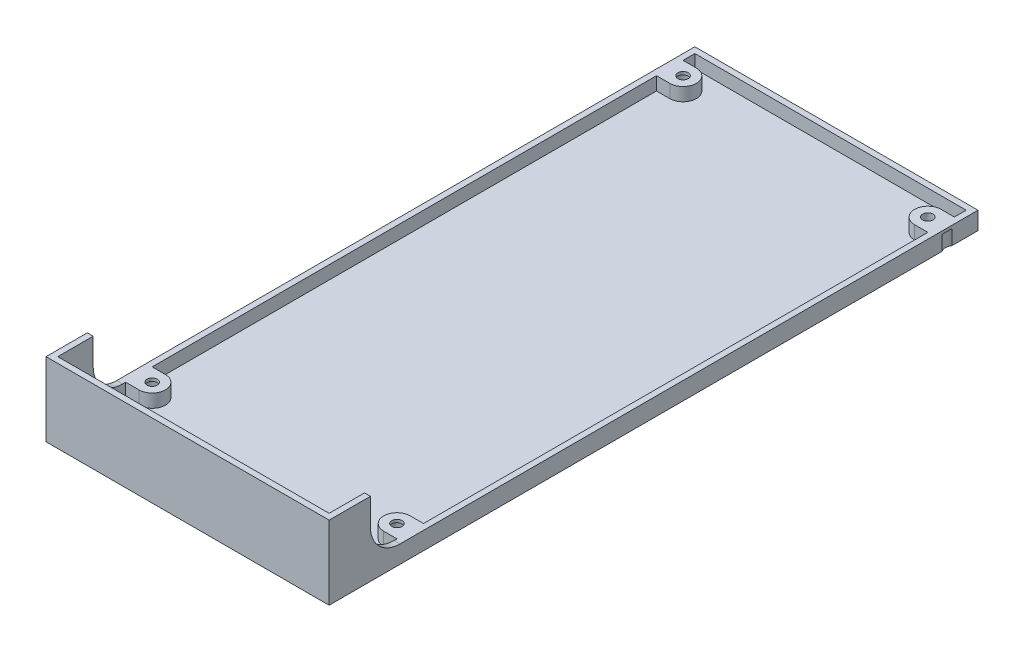
from build123d import *

# Parameters (mm, degrees)
SKETCH1_W           = 96
SKETCH1_H           = 220
BOSS_EXTRUDE1_DEPTH = 25
CUT_EXTRUDE1_DEPTH  = 23.5
CUT_EXTRUDE2_REACH  = 248.327
CUT_EXTRUDE3_REACH  = 247.79
SKETCH4_R           = 1.75
SKETCH5_R           = 3
CUT_EXTRUDE4_DEPTH  = 5


with BuildPart() as part:
    # Sketch1 → Boss-Extrude1 (new body)
    with BuildSketch(Plane(origin=(0, 0, 0), x_dir=(1, 0, 0), z_dir=(0, 1, 0))):
        with Locations((48, 115.467836257)):
            Rectangle(SKETCH1_W, SKETCH1_H)
    extrude(amount=BOSS_EXTRUDE1_DEPTH)

    # Sketch2 → Cut-Extrude1 (cut)
    with BuildSketch(Plane(origin=(0, 25, 0), x_dir=(1, 0, 0), z_dir=(0, 1, 0))):
        with BuildLine():
            Line((2, 223.467836257), (2, 219.467836257))
            Line((2, 219.467836257), (6.5, 219.467836257))
            ThreePointArc((6.5, 219.467836257), (11, 214.967836257), (6.5, 210.467836257))
            Line((6.5, 210.467836257), (2, 210.467836257))
            Line((2, 210.467836257), (2, 39.467836257))
            Line((2, 39.467836257), (6.5, 39.467836257))
            ThreePointArc((6.5, 39.467836257), (11, 34.967836257), (6.5, 30.467836257))
            Line((6.5, 30.467836257), (2, 30.467836257))
            Line((2, 30.467836257), (2, 7.467836257))
            Line((2, 7.467836257), (94, 7.467836257))
            Line((94, 7.467836257), (94, 30.467836257))
            Line((94, 30.467836257), (89.5, 30.467836257))
            ThreePointArc((89.5, 30.467836257), (85, 34.967836257), (89.5, 39.467836257))
            Line((89.5, 39.467836257), (94, 39.467836257))
            Line((94, 39.467836257), (94, 210.467836257))
            Line((94, 210.467836257), (89.5, 210.467836257))
            ThreePointArc((89.5, 210.467836257), (85, 214.967836257), (89.5, 219.467836257))
            Line((89.5, 219.467836257), (94, 219.467836257))
            Line((94, 219.467836257), (94, 223.467836257))
            Line((94, 223.467836257), (2, 223.467836257))
        make_face()
    extrude(amount=-CUT_EXTRUDE1_DEPTH, mode=Mode.SUBTRACT)

    # Cut-Extrude2: up to this face of the body (flat: up to its plane)
    cut_extrude2_end = Plane(part.part.faces().sort_by_distance((0, 12.5, -115.467836257))[0])
    # Sketch3 → Cut-Extrude2 (cut, up to the picked face)
    with BuildSketch(Plane(origin=(96, 0, 0), x_dir=(0, 0, -1), z_dir=(1, 0, 0)), mode=Mode.PRIVATE) as cut_extrude2_sk1:
        with BuildLine():
            Line((225.467836257, 6), (29.467836257, 6))
            ThreePointArc((29.467836257, 6), (22.396768445, 8.928932188), (19.467836257, 16))
            Line((19.467836257, 16), (19.467836257, 25))
            Line((19.467836257, 25), (225.467836257, 25))
            Line((225.467836257, 25), (225.467836257, 6))
        make_face()
    cut_extrude2_tool1 = split(extrude(cut_extrude2_sk1.sketch, amount=-CUT_EXTRUDE2_REACH, mode=Mode.PRIVATE), bisect_by=cut_extrude2_end, keep=Keep.BOTH, mode=Mode.PRIVATE)
    add(cut_extrude2_tool1.solids().sort_by(Axis((96, 15.54006, -123.023377), (-1, 0, 0)))[0], mode=Mode.SUBTRACT)

    # Sketch4 → Cut-Extrude3 (cut, up to next)
    with BuildSketch(Plane(origin=(0, 6, 0), x_dir=(1, 0, 0), z_dir=(0, 1, 0)), mode=Mode.PRIVATE) as cut_extrude3_sk1:
        with Locations(Location((6.5, 34.967836257, 0), (0, 0, 270))):
            Circle(SKETCH4_R)
    cut_extrude3_tool1 = extrude(cut_extrude3_sk1.sketch, amount=-CUT_EXTRUDE3_REACH, mode=Mode.PRIVATE) & part.part
    # Sketch4 → Cut-Extrude3 (cut, up to next)
    with BuildSketch(Plane(origin=(0, 6, 0), x_dir=(1, 0, 0), z_dir=(0, 1, 0)), mode=Mode.PRIVATE) as cut_extrude3_sk2:
        with Locations(Location((89.5, 34.967836257, 0), (0, 0, 270))):
            Circle(SKETCH4_R)
    cut_extrude3_tool2 = extrude(cut_extrude3_sk2.sketch, amount=-CUT_EXTRUDE3_REACH, mode=Mode.PRIVATE) & part.part
    # Sketch4 → Cut-Extrude3 (cut, up to next)
    with BuildSketch(Plane(origin=(0, 6, 0), x_dir=(1, 0, 0), z_dir=(0, 1, 0)), mode=Mode.PRIVATE) as cut_extrude3_sk3:
        with Locations(Location((89.5, 214.967836257, 0), (0, 0, 270))):
            Circle(SKETCH4_R)
    cut_extrude3_tool3 = extrude(cut_extrude3_sk3.sketch, amount=-CUT_EXTRUDE3_REACH, mode=Mode.PRIVATE) & part.part
    # Sketch4 → Cut-Extrude3 (cut, up to next)
    with BuildSketch(Plane(origin=(0, 6, 0), x_dir=(1, 0, 0), z_dir=(0, 1, 0)), mode=Mode.PRIVATE) as cut_extrude3_sk4:
        with Locations(Location((6.5, 214.967836257, 0), (0, 0, 270))):
            Circle(SKETCH4_R)
    cut_extrude3_tool4 = extrude(cut_extrude3_sk4.sketch, amount=-CUT_EXTRUDE3_REACH, mode=Mode.PRIVATE) & part.part
    add(cut_extrude3_tool1.solids().sort_by_distance((6.5, 6, -34.967836))[0], mode=Mode.SUBTRACT)
    add(cut_extrude3_tool2.solids().sort_by_distance((89.5, 6, -34.967836))[0], mode=Mode.SUBTRACT)
    add(cut_extrude3_tool3.solids().sort_by_distance((89.5, 6, -214.967836))[0], mode=Mode.SUBTRACT)
    add(cut_extrude3_tool4.solids().sort_by_distance((6.5, 6, -214.967836))[0], mode=Mode.SUBTRACT)

    # Sketch5 → Cut-Extrude4 (cut)
    with BuildSketch(Plane.XZ):
        with Locations(Location((6.5, -34.967836257, 0), (0, 0, 270))):
            Circle(SKETCH5_R)
        with Locations(Location((89.5, -34.967836257, 0), (0, 0, 270))):
            Circle(SKETCH5_R)
        with Locations(Location((6.5, -214.967836257, 0), (0, 0, 270))):
            Circle(SKETCH5_R)
        with Locations((98.5, -214.967836257)):
            Circle(SKETCH5_R)
    extrude(amount=-CUT_EXTRUDE4_DEPTH, mode=Mode.SUBTRACT)


solid = part.part
